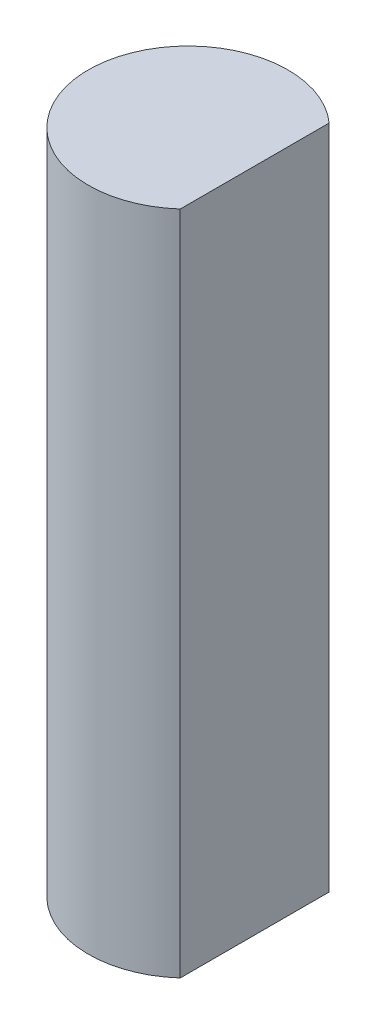
from build123d import *

# Parameters (mm, degrees)
BOSS_EXTRUDE1_DEPTH = 10


with BuildPart() as part:
    # Sketch1 → Boss-Extrude1 (new body)
    with BuildSketch(Plane(origin=(0, 0, 0), x_dir=(1, 0, 0), z_dir=(0, 1, 0))):
        with BuildLine():
            Line((1, 1.118033989), (1, -1.118033989))
            ThreePointArc((1, -1.118033989), (-1.5, 0), (1, 1.118033989))
        make_face()
    extrude(amount=BOSS_EXTRUDE1_DEPTH)


solid = part.part
